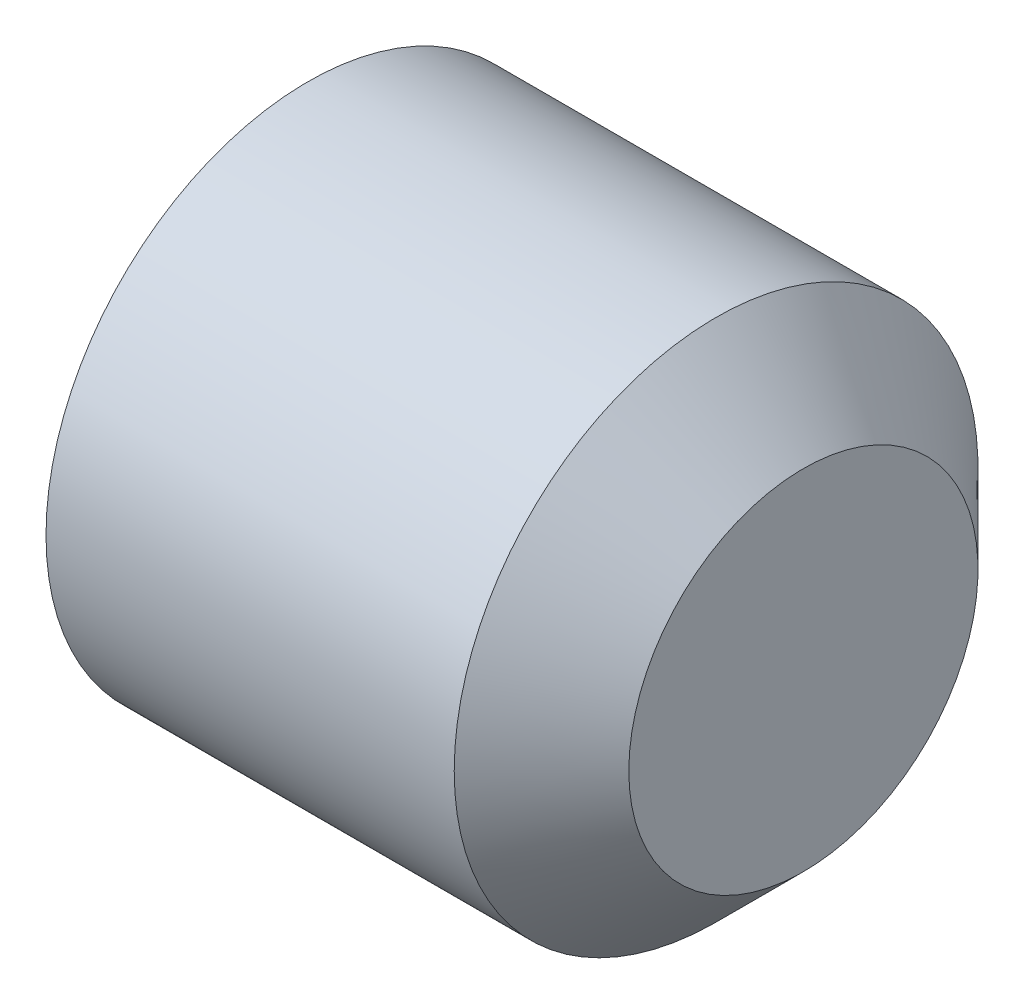
from build123d import *

# Parameters (mm, degrees)
HEX_2_DEPTH = 1.5


with BuildPart() as part:
    # BodySke → BaseBody (revolve)
    with BuildSketch(Plane.XY, mode=Mode.PRIVATE) as basebody_sk:
        Polygon((0, 0), (0, 1.2195), (0.161946751, 1.5), (2.5, 1.5), (3, 1), (3, 0), align=None)
    revolve(basebody_sk.sketch.rotate(Axis((-12.7, 0, 0), (1, 0, 0)), 90), axis=Axis((-12.7, 0, 0), (1, 0, 0)))

    # Sketch2 → Hex 2 (cut)
    with BuildSketch(Plane.ZY):
        Polygon((0.433012702, 0.75), (-0.433012702, 0.75), (-0.866025404, 0), (-0.433012702, -0.75), (0.433012702, -0.75), (0.866025404, 0), align=None)
    extrude(amount=-HEX_2_DEPTH, mode=Mode.SUBTRACT)


solid = part.part
